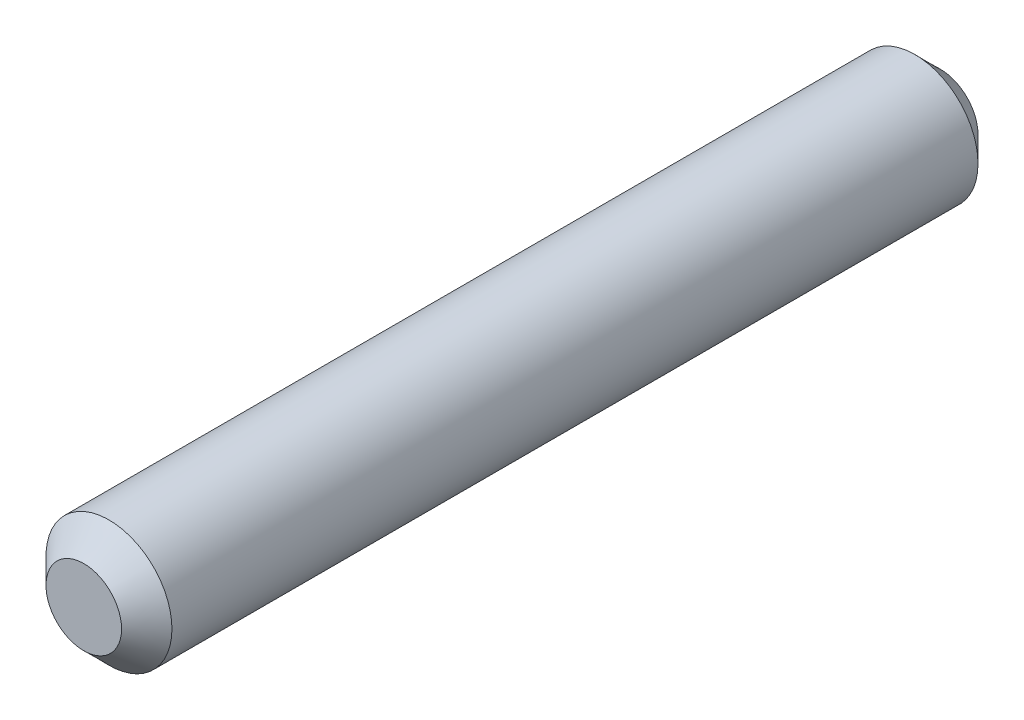
from build123d import *

# Parameters (mm, degrees)
SKETCH1_R           = 1.5875
BOSS_EXTRUDE1_DEPTH = 21.59
CHAMFER1_SIZE       = 0.635


with BuildPart() as part:
    # Sketch1 → Boss-Extrude1 (new body)
    with BuildSketch(Plane.XY):
        Circle(SKETCH1_R)
    extrude(amount=BOSS_EXTRUDE1_DEPTH)

    # Chamfer1
    chamfer1_edges = [part.edges().sort_by_distance(p)[0] for p in [
        (-1.5875, 0, 0),
        (-1.5875, 0, 21.59),
    ]]
    chamfer(chamfer1_edges, length=CHAMFER1_SIZE)


solid = part.part
